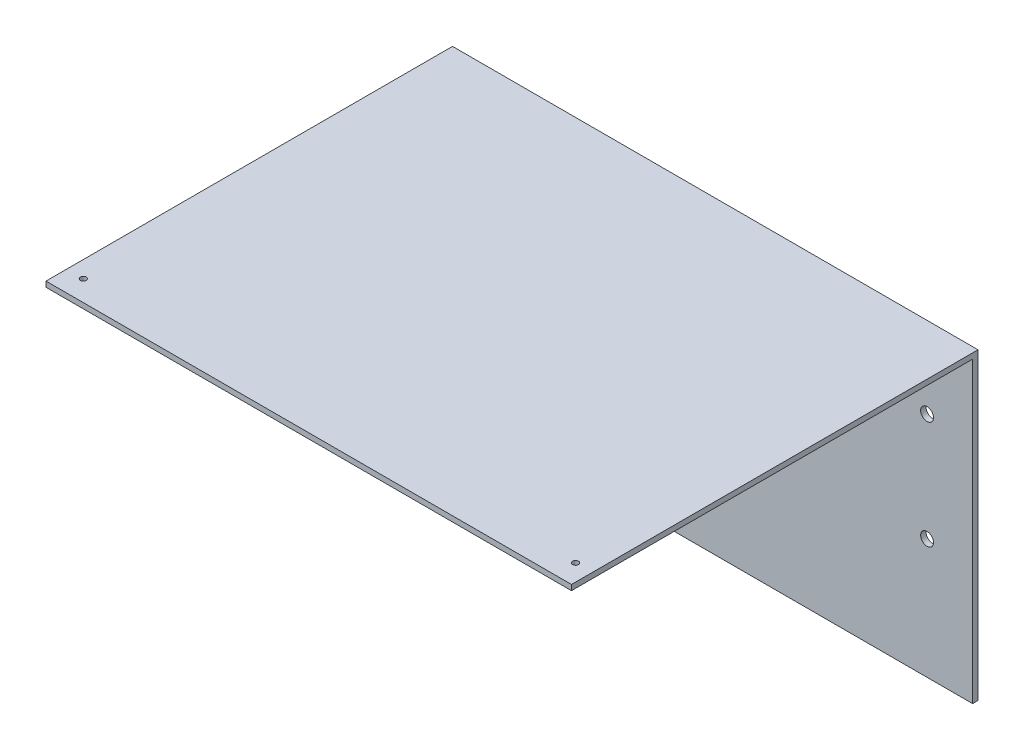
from build123d import *

# Parameters (mm, degrees)
SKETCH1_W               = 291.5
SKETCH1_H               = 168.5
BOSS_EXTRUDE1_DEPTH     = 3
F_1_4_CLEARANCE_HOLE1_D = 7.14248
SKETCH6_W               = 291.5
SKETCH6_H               = 3
BOSS_EXTRUDE2_DEPTH     = 222.5
TAP_DRILL_FOR_M4_TAP2_D = 3.3


with BuildPart() as part:
    # Sketch1 → Boss-Extrude1 (new body)
    with BuildSketch(Plane.XY):
        with Locations((145.75, -84.25)):
            Rectangle(SKETCH1_W, SKETCH1_H)
    extrude(amount=BOSS_EXTRUDE1_DEPTH)

    # 1/4 Clearance Hole1 (through all)
    with Locations(Plane.XY.offset(3)):
        with Locations((25.25, -102), (25.25, -42), (266.25, -42), (266.25, -102)):
            Hole(F_1_4_CLEARANCE_HOLE1_D / 2)

    # Sketch6 → Boss-Extrude2 (add)
    with BuildSketch(Plane.XY.offset(3)):
        with Locations((145.75, -1.5)):
            Rectangle(SKETCH6_W, SKETCH6_H)
    extrude(amount=BOSS_EXTRUDE2_DEPTH)

    # Tap Drill for M4 Tap2 (through all)
    with Locations(Plane(origin=(0, 0, 0), x_dir=(1, 0, 0), z_dir=(0, 1, 0))):
        with Locations((9.25, -214), (282.25, -214)):
            Hole(TAP_DRILL_FOR_M4_TAP2_D / 2)


solid = part.part
